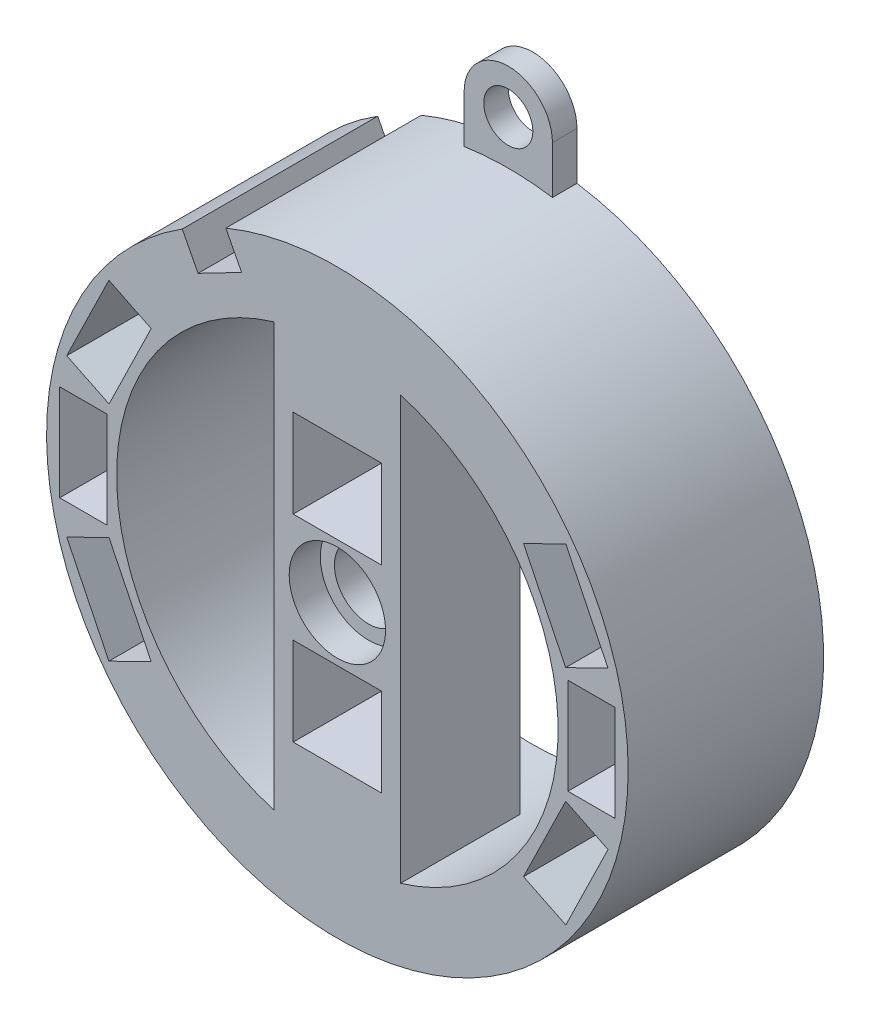
from build123d import *

# Parameters (mm, degrees)
SKETCH1_R                       = 29.64
SKETCH1_R_2                     = 22.5
BOSS_EXTRUDE1_DEPTH             = 19.92
SKETCH4_W                       = 12.873355566
SKETCH4_H                       = 48.428243032
BOSS_EXTRUDE3_DEPTH             = 3.175
CUT_EXTRUDE2_REACH              = 48.41
SKETCH7_R                       = 4.9125
CUT_EXTRUDE2_DIRECTION_2_DEPTH  = 47.409757595
SKETCH8_W                       = 12.873355566
SKETCH8_H                       = 48.17275248
SKETCH8_R                       = 3.475
BOSS_EXTRUDE4_DEPTH             = 9
SKETCH1_3_W                     = 4.8
SKETCH1_3_H                     = 9.8
CUT_EXTRUDE1_DEPTH              = 20
CIRPATTERN1_COUNT               = 2
CIRPATTERN1_ANGLE               = 26
CIRPATTERN1_THE_OTHER_WAY_COUNT = 2
CIRPATTERN1_THE_OTHER_WAY_ANGLE = 26
SKETCH11_W                      = 9
SKETCH11_H                      = 9
CUT_EXTRUDE21_DEPTH             = 29
BOSS_EXTRUDE5_DEPTH             = 2.5
MIRROR3_COPY_1_SKETCH_W         = 4.8
MIRROR3_COPY_1_SKETCH_H         = 9.8
MIRROR3_COPY_1_DEPTH            = 20
MIRROR3_COPY_2_SKETCH_W         = 4.8
MIRROR3_COPY_2_SKETCH_H         = 9.8
MIRROR3_COPY_2_DEPTH            = 20
CUT_EXTRUDE22_DEPTH             = 53.615450202
CUT_EXTRUDE22_DEPTH_BACK        = 53.615450202


with BuildPart() as part:
    # Sketch1 → Boss-Extrude1 (new body)
    with BuildSketch(Plane.XY):
        Circle(SKETCH1_R)
        Circle(SKETCH1_R_2, mode=Mode.SUBTRACT)
    extrude(amount=BOSS_EXTRUDE1_DEPTH)

    # Sketch4 → Boss-Extrude3 (add)
    with BuildSketch(Plane.XY.offset(19.92)):
        Rectangle(SKETCH4_W, SKETCH4_H)
    extrude(amount=-BOSS_EXTRUDE3_DEPTH)

    # Sketch7 → Cut-Extrude2 (cut, up to next)
    with BuildSketch(Plane.XY.offset(19.92), mode=Mode.PRIVATE) as cut_extrude2_sk1:
        with Locations(Location((0, 0, 0), (0, 0, 180))):
            Circle(SKETCH7_R)
    cut_extrude2_tool1 = extrude(cut_extrude2_sk1.sketch, amount=-CUT_EXTRUDE2_REACH, mode=Mode.PRIVATE) & part.part
    add(cut_extrude2_tool1.solids().sort_by_distance((0, 0, 19.92))[0], mode=Mode.SUBTRACT)

    # Sketch7 → Cut-Extrude2 direction 2 (cut)
    with BuildSketch(Plane.XY.offset(19.92)):
        with Locations(Location((0, 0, 0), (0, 0, 180))):
            Circle(SKETCH7_R)
    extrude(amount=CUT_EXTRUDE2_DIRECTION_2_DEPTH, mode=Mode.SUBTRACT)

    # Sketch8 → Boss-Extrude4 (add)
    with BuildSketch(Plane.XY.offset(16.745)):
        Rectangle(SKETCH8_W, SKETCH8_H)
        Circle(SKETCH8_R, mode=Mode.SUBTRACT)
    extrude(amount=-BOSS_EXTRUDE4_DEPTH)

    # Sketch1<3> → Cut-Extrude1 (cut)
    with BuildSketch(Plane.XY):
        with Locations((25.9, 0)):
            Rectangle(SKETCH1_3_W, SKETCH1_3_H)
    cut_extrude1 = extrude(amount=CUT_EXTRUDE1_DEPTH, mode=Mode.SUBTRACT)

    # CirPattern1: Cut-Extrude1 ×2 about axis
    cirpattern1_axis = Axis((0, 0, 0), (0, 0, 1))
    for i in range(1, CIRPATTERN1_COUNT):
        add(cut_extrude1.rotate(cirpattern1_axis, i * CIRPATTERN1_ANGLE / (CIRPATTERN1_COUNT - 1)), mode=Mode.SUBTRACT)

    # CirPattern1 the other way: Cut-Extrude1 ×2 about axis
    cirpattern1_the_other_way_axis = Axis((0, 0, 0), (0, 0, -1))
    for i in range(1, CIRPATTERN1_THE_OTHER_WAY_COUNT):
        add(cut_extrude1.rotate(cirpattern1_the_other_way_axis, i * CIRPATTERN1_THE_OTHER_WAY_ANGLE / (CIRPATTERN1_THE_OTHER_WAY_COUNT - 1)), mode=Mode.SUBTRACT)

    # Sketch11 → Cut-Extrude21 (cut)
    with BuildSketch(Plane(origin=(0, 0, 19.92), x_dir=(-1, 0, 0), z_dir=(0, 0, -1))):
        with Locations((0, 10.0625)):
            Rectangle(SKETCH11_W, SKETCH11_H)
    cut_extrude21 = extrude(amount=CUT_EXTRUDE21_DEPTH, mode=Mode.SUBTRACT)

    # Mirror1: Cut-Extrude21 across plane
    add(cut_extrude21.mirror(Plane.ZX), mode=Mode.SUBTRACT)

    # Sketch12 → Boss-Extrude5 (add)
    with BuildSketch(Plane(origin=(0, 0, 0), x_dir=(-1, 0, 0), z_dir=(0, 0, -1))):
        with BuildLine():
            Line((0, 29.64), (0, 31.64))
            ThreePointArc((0, 31.64), (-1.767766953, 32.372233047), (-2.5, 34.14))
            Line((-2.5, 34.14), (-4.5, 34.14))
            Line((-4.5, 34.14), (-4.5, 29.296409336))
            ThreePointArc((-4.5, 29.296409336), (-2.256549055, 29.553977505), (0, 29.64))
        make_face()
        with BuildLine():
            ThreePointArc((2.5, 34.14), (1.767766953, 32.372233047), (0, 31.64))
            Line((0, 31.64), (0, 29.64))
            ThreePointArc((0, 29.64), (2.256549055, 29.553977505), (4.5, 29.296409336))
            Line((4.5, 29.296409336), (4.5, 34.14))
            ThreePointArc((4.5, 34.14), (0, 38.64), (-4.5, 34.14))
            Line((-4.5, 34.14), (-2.5, 34.14))
            ThreePointArc((-2.5, 34.14), (0, 36.64), (2.5, 34.14))
        make_face()
    boss_extrude5 = extrude(amount=-BOSS_EXTRUDE5_DEPTH)

    # Mirror2: Boss-Extrude5 across plane
    add(boss_extrude5.mirror(Plane.ZX))

    # Mirror3: Cut-Extrude1 across plane
    add(cut_extrude1.mirror(Plane(origin=(0, 0, 0), x_dir=(0, 0, 1), z_dir=(1, 0, 0))), mode=Mode.SUBTRACT)

    # Mirror3 copy 1 sketch → Mirror3 copy 1 (cut)
    with BuildSketch(Plane(origin=(0, 0, 0), x_dir=(-0.8987940462991663, 0.43837114678907885, 0), z_dir=(0, 0, 1))):
        with Locations((25.9, 0)):
            Rectangle(MIRROR3_COPY_1_SKETCH_W, MIRROR3_COPY_1_SKETCH_H)
    extrude(amount=MIRROR3_COPY_1_DEPTH, mode=Mode.SUBTRACT)

    # Mirror3 copy 2 sketch → Mirror3 copy 2 (cut)
    with BuildSketch(Plane(origin=(0, 0, 0), x_dir=(-0.8987940462991663, -0.43837114678907885, 0), z_dir=(0, 0, 1))):
        with Locations((25.9, 0)):
            Rectangle(MIRROR3_COPY_2_SKETCH_W, MIRROR3_COPY_2_SKETCH_H)
    extrude(amount=MIRROR3_COPY_2_DEPTH, mode=Mode.SUBTRACT)

    # Sketch13 → Cut-Extrude22 (cut, two sides: drawn at the far end of the back side and taken through both)
    with BuildSketch(Plane.XY.offset(-CUT_EXTRUDE22_DEPTH_BACK)):
        Polygon((-9.760082808, 24.264783614), (-14.199291993, 21.964039863), (-15.809812619, 25.071486294), (-11.370603433, 27.372230044), align=None)
        Polygon((-16.779237208, 26.941959066), (-12.340028022, 29.242702816), (-11.370603433, 27.372230044), (-15.809812619, 25.071486294), align=None)
    extrude(amount=CUT_EXTRUDE22_DEPTH + CUT_EXTRUDE22_DEPTH_BACK, mode=Mode.SUBTRACT)


solid = part.part
